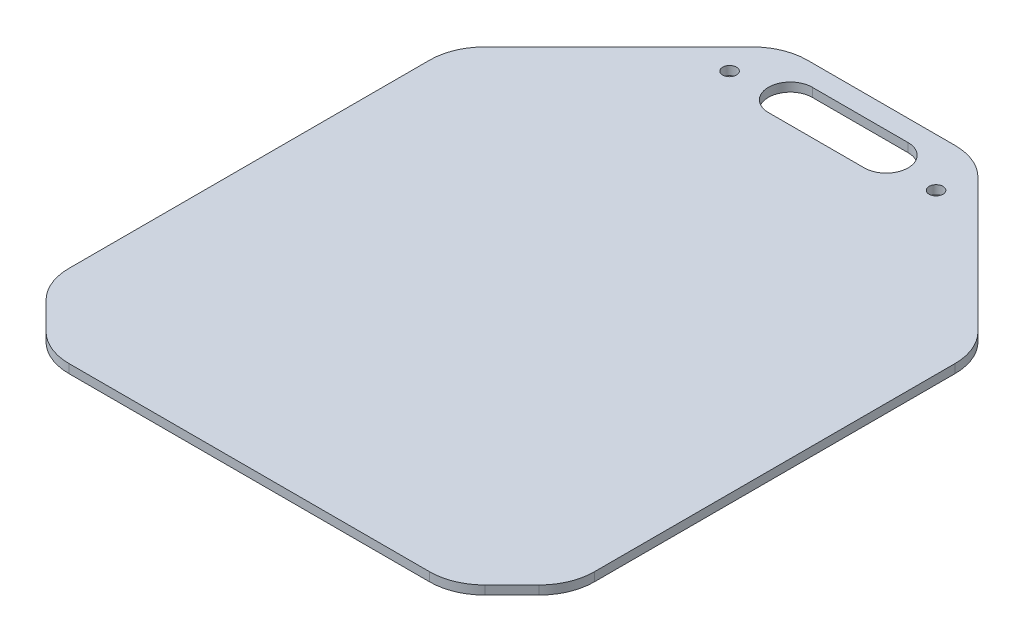
from build123d import *

# Parameters (mm, degrees)
BODY_DEPTH                    = 6.35
HANDLE_DEPTH                  = 6.35
SKETCH11_R                    = 5
LOCKING_MECHANISM_HOLES_DEPTH = 6.36
FILLET1_R                     = 40
FILLET2_R                     = 40
SKETCH12_W                    = 10
SKETCH12_H                    = 30
BOSS_EXTRUDE1_DEPTH           = 4


with BuildPart() as part:
    # Sketch1 → Body (new body)
    with BuildSketch(Plane(origin=(0, 0, 0), x_dir=(1, 0, 0), z_dir=(0, 1, 0))):
        Polygon((0, 0), (294, 0), (336.996020767, 43.003978862), (336.996020767, 337.003978862), (217, 456.999999629), (77, 456.999999629), (-42.996020767, 337.003978862), (-42.996020767, 43.003978862), align=None)
    extrude(amount=BODY_DEPTH)

    # Sketch2 → Handle (cut)
    with BuildSketch(Plane(origin=(0, 6.35, 0), x_dir=(1, 0, 0), z_dir=(0, 1, 0))):
        with BuildLine():
            Line((112.35, 441.799999629), (181.65, 441.799999629))
            ThreePointArc((181.65, 441.799999629), (197.5, 425.949999629), (181.65, 410.099999629))
            Line((181.65, 410.099999629), (112.35, 410.099999629))
            ThreePointArc((112.35, 410.099999629), (96.5, 425.949999629), (112.35, 441.799999629))
        make_face()
    extrude(amount=-HANDLE_DEPTH, mode=Mode.SUBTRACT)

    # Sketch11 → Locking Mechanism Holes (cut)
    with BuildSketch(Plane(origin=(0, 6.35, 0), x_dir=(1, 0, 0), z_dir=(0, 1, 0))):
        with Locations(Location((221.65, 421.999999629, 0), (0, 0, 270))):
            Circle(SKETCH11_R)
        with Locations(Location((72.35, 421.999999629, 0), (0, 0, 270))):
            Circle(SKETCH11_R)
    extrude(amount=-LOCKING_MECHANISM_HOLES_DEPTH, mode=Mode.SUBTRACT)

    # Fillet1
    fillet1_edges = [part.edges().sort_by_distance(p)[0] for p in [
        (77, 3.175, -456.999999629),
        (217, 3.175, -456.999999629),
    ]]
    fillet(fillet1_edges, radius=FILLET1_R)

    # Fillet2
    fillet2_edges = [part.edges().sort_by_distance(p)[0] for p in [
        (-42.996020767, 3.175, -43.003978862),
        (-42.996020767, 3.175, -337.003978862),
        (336.996020767, 3.175, -337.003978862),
        (336.996020767, 3.175, -43.003978862),
        (294, 3.175, 0),
        (0, 3.175, 0),
    ]]
    fillet(fillet2_edges, radius=FILLET2_R)

    # Sketch12 → Boss-Extrude1 (add)
    with BuildSketch(Plane.XZ):
        with Locations((252.4, -251.999999629)):
            Rectangle(SKETCH12_W, SKETCH12_H)
        with Locations((41.6, -131.999999629)):
            Rectangle(SKETCH12_W, SKETCH12_H)
        with Locations((41.6, -251.999999629)):
            Rectangle(SKETCH12_W, SKETCH12_H)
        with Locations((252.4, -131.999999629)):
            Rectangle(SKETCH12_W, SKETCH12_H)
    extrude(amount=BOSS_EXTRUDE1_DEPTH)


solid = part.part
